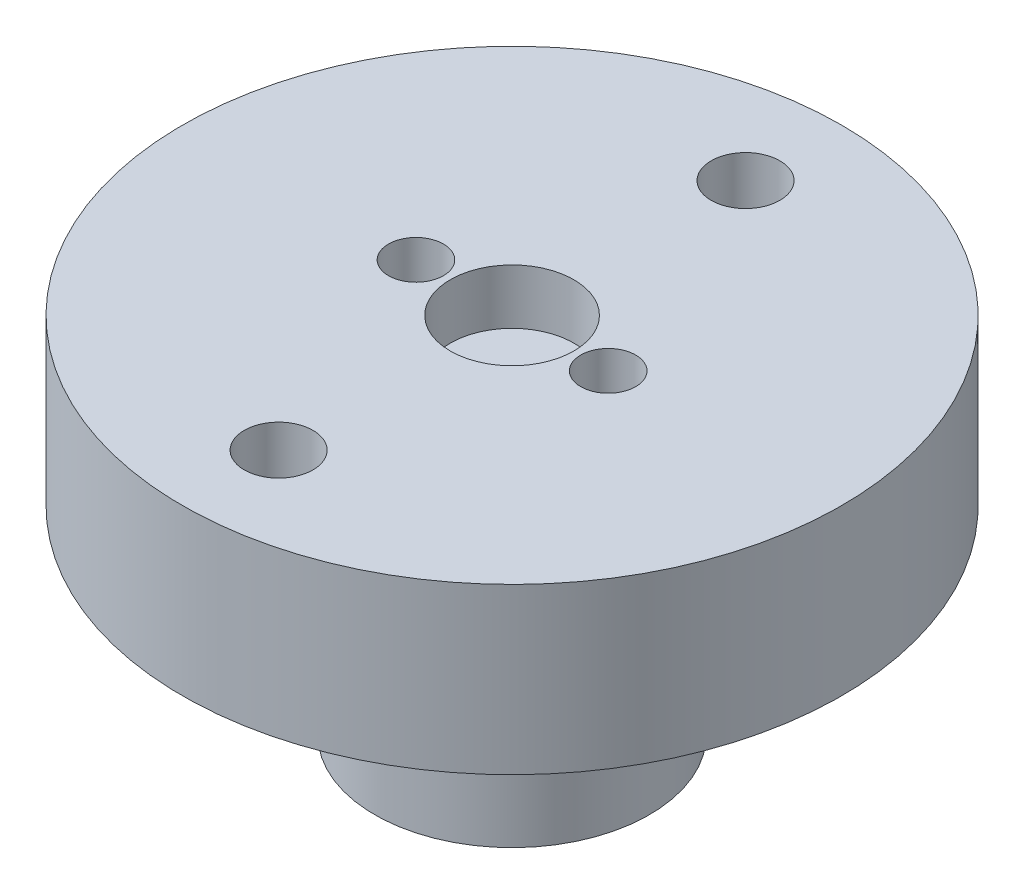
from build123d import *

# Parameters (mm, degrees)
SKETCH2_R          = 1
CUT_EXTRUDE1_DEPTH = 22.53050162
CIRPATTERN1_COUNT  = 2
SKETCH5_R          = 1.25
CUT_EXTRUDE4_DEPTH = 10
SKETCH3_R          = 2.75
CUT_EXTRUDE2_DEPTH = 8
SKETCH4_R          = 2.25
CUT_EXTRUDE3_DEPTH = 2


with BuildPart() as part:
    # Sketch1 → Revolve1 (revolve)
    with BuildSketch(Plane.XY, mode=Mode.PRIVATE) as revolve1_sk:
        Polygon((0, 13.25), (0, 0), (5, 0), (5, 5.25), (6, 5.25), (6, 7.25), (12, 7.25), (12, 13.25), align=None)
    revolve(revolve1_sk.sketch.rotate(Axis((0, 0, 0), (0, 1, 0)), 90), axis=Axis((0, 0, 0), (0, 1, 0)))

    # Sketch2 → Cut-Extrude1 (cut, through all)
    with BuildSketch(Plane(origin=(0, 13.25, 0), x_dir=(1, 0, 0), z_dir=(0, 1, 0))):
        with Locations(Location((3.5, 0, 0), (0, 0, 270))):
            Circle(SKETCH2_R)
    cut_extrude1 = extrude(amount=-CUT_EXTRUDE1_DEPTH, mode=Mode.SUBTRACT)

    # CirPattern1: Cut-Extrude1 ×2 about axis
    cirpattern1_axis = Axis((0, 0, 0), (0, 1, 0))
    for i in range(1, CIRPATTERN1_COUNT):
        add(cut_extrude1.rotate(cirpattern1_axis, i * 360 / CIRPATTERN1_COUNT), mode=Mode.SUBTRACT)

    # Sketch5 → Cut-Extrude4 (cut)
    with BuildSketch(Plane(origin=(0, 13.25, 0), x_dir=(1, 0, 0), z_dir=(0, 1, 0))):
        with Locations(Location((0, 8.5, 0), (0, 0, 270))):
            Circle(SKETCH5_R)
        with Locations(Location((0, -8.5, 0), (0, 0, 270))):
            Circle(SKETCH5_R)
    extrude(amount=-CUT_EXTRUDE4_DEPTH, mode=Mode.SUBTRACT)

    # Sketch3 → Cut-Extrude2 (cut)
    with BuildSketch(Plane.XZ):
        with Locations(Location((0, 8.5, 0), (0, 0, 270))):
            Circle(SKETCH3_R)
        with Locations(Location((0, -8.5, 0), (0, 0, 270))):
            Circle(SKETCH3_R)
    extrude(amount=-CUT_EXTRUDE2_DEPTH, mode=Mode.SUBTRACT)

    # Sketch4 → Cut-Extrude3 (cut)
    with BuildSketch(Plane(origin=(0, 13.25, 0), x_dir=(1, 0, 0), z_dir=(0, 1, 0))):
        with Locations(Location((0, 0, 0), (0, 0, 270))):
            Circle(SKETCH4_R)
    extrude(amount=-CUT_EXTRUDE3_DEPTH, mode=Mode.SUBTRACT)


solid = part.part
